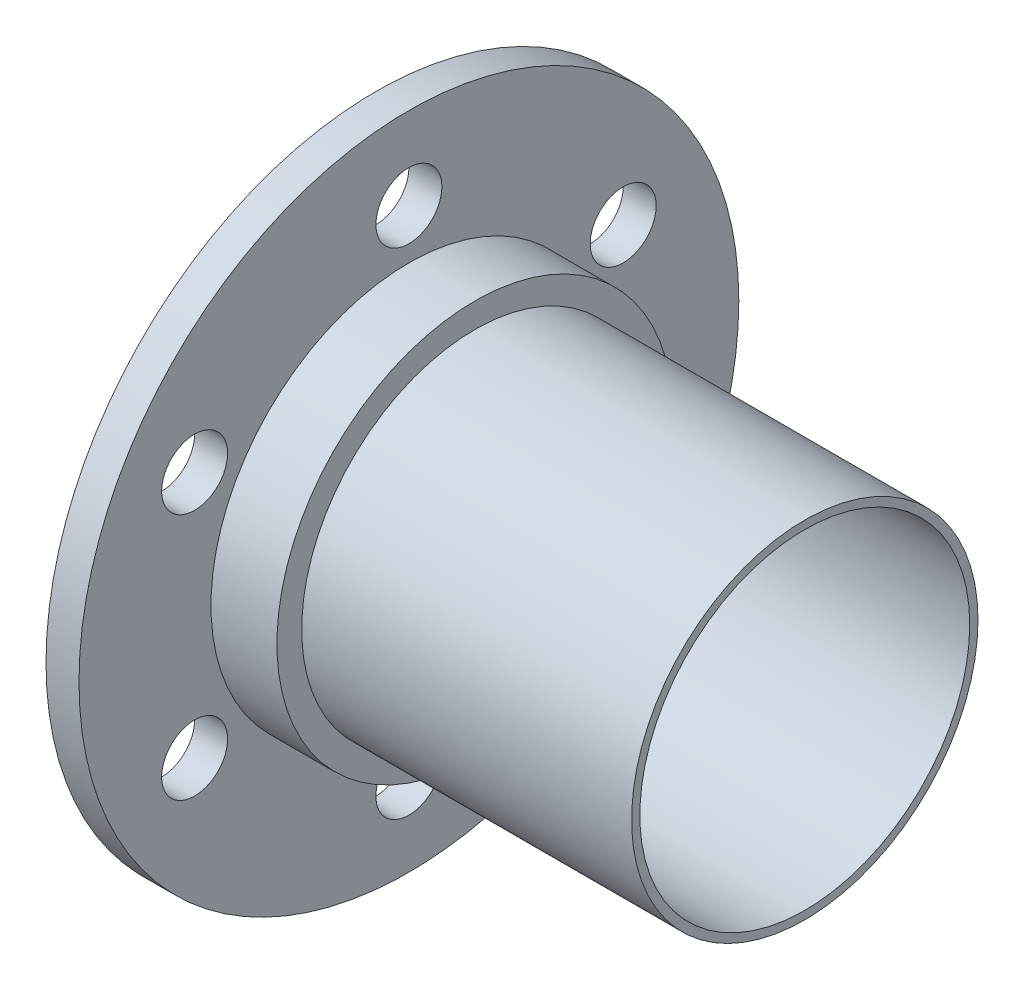
from build123d import *

# Parameters (mm, degrees)
SKETCH1_R           = 100
SKETCH1_R_2         = 52.5
SKETCH1_R_3         = 10
BOSS_EXTRUDE1_DEPTH = 10
BOSS_EXTRUDE2_START = 20
SKETCH2_R           = 60
SKETCH2_R_2         = 52.5
BOSS_EXTRUDE2_DEPTH = 20
SKETCH3_R           = 52.5
SKETCH3_R_2         = 50
BOSS_EXTRUDE3_DEPTH = 100


with BuildPart() as part:
    # Sketch1 → Boss-Extrude1 (new body)
    with BuildSketch(Plane(origin=(0, 0, 0), x_dir=(0, 0, -1), z_dir=(1, 0, 0))):
        Circle(SKETCH1_R)
        Circle(SKETCH1_R_2, mode=Mode.SUBTRACT)
        with Locations((0, 75)):
            Circle(SKETCH1_R_3, mode=Mode.SUBTRACT)
        with Locations((64.951905284, 37.5)):
            Circle(SKETCH1_R_3, mode=Mode.SUBTRACT)
        with Locations((64.951905284, -37.5)):
            Circle(SKETCH1_R_3, mode=Mode.SUBTRACT)
        with Locations((0, -75)):
            Circle(SKETCH1_R_3, mode=Mode.SUBTRACT)
        with Locations((-64.951905284, -37.5)):
            Circle(SKETCH1_R_3, mode=Mode.SUBTRACT)
        with Locations((-64.951905284, 37.5)):
            Circle(SKETCH1_R_3, mode=Mode.SUBTRACT)
    extrude(amount=-BOSS_EXTRUDE1_DEPTH)

    # Sketch2 → Boss-Extrude2 (add)
    with BuildSketch(Plane(origin=(0, 0, 0), x_dir=(0, 0, -1), z_dir=(1, 0, 0)).offset(BOSS_EXTRUDE2_START)):
        Circle(SKETCH2_R)
        Circle(SKETCH2_R_2, mode=Mode.SUBTRACT)
    extrude(amount=-BOSS_EXTRUDE2_DEPTH)


with BuildPart() as body_2:
    # Sketch3 → Boss-Extrude3 (new body)
    with BuildSketch(Plane(origin=(20, 0, 0), x_dir=(0, 0, -1), z_dir=(1, 0, 0))):
        Circle(SKETCH3_R)
        Circle(SKETCH3_R_2, mode=Mode.SUBTRACT)
    extrude(amount=BOSS_EXTRUDE3_DEPTH)


solid = Compound([part.part, body_2.part])
